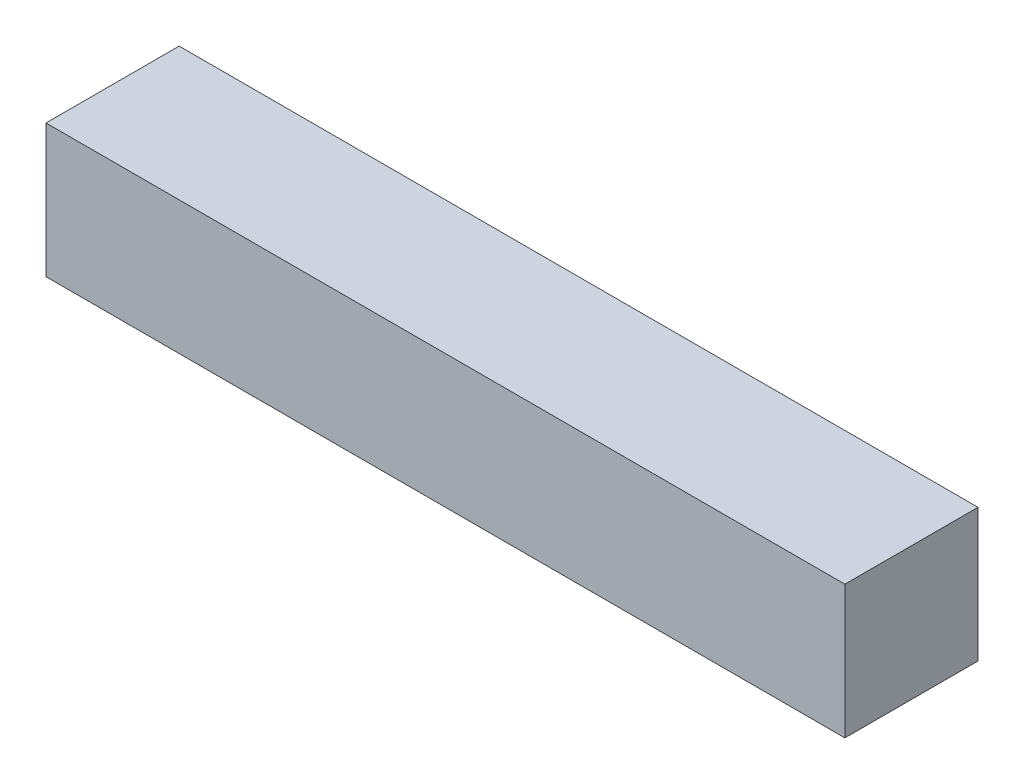
from build123d import *

# Parameters (mm, degrees)
SKETCH1_W      = 38.1
SKETCH1_H      = 6.35
EXTRUDE1_DEPTH = 6.35


with BuildPart() as part:
    # Sketch1 → Extrude1 (new body)
    with BuildSketch(Plane.XY):
        Rectangle(SKETCH1_W, SKETCH1_H)
    extrude(amount=EXTRUDE1_DEPTH)


solid = part.part
